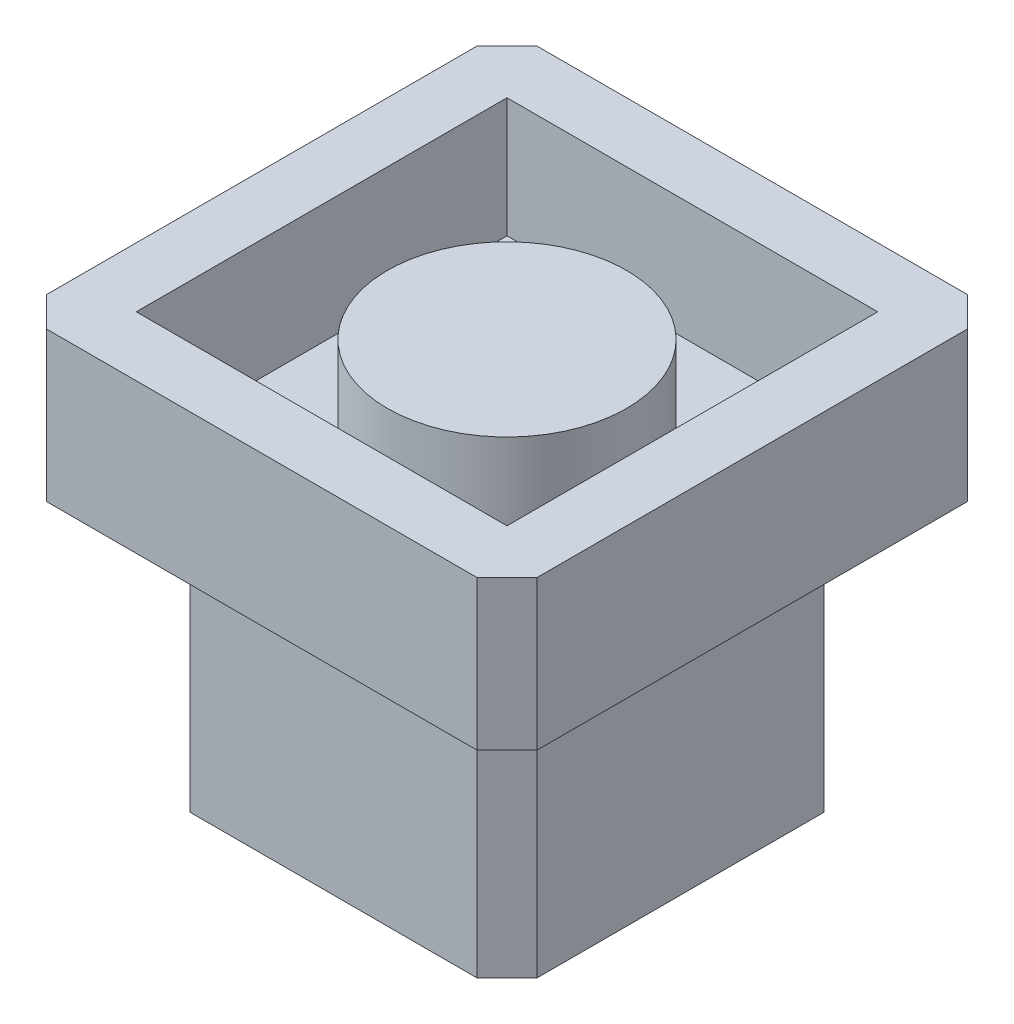
from build123d import *

# Parameters (mm, degrees)
SKETCH1_R           = 2
BOSS_EXTRUDE1_DEPTH = 1.6
SKETCH1_3_W         = 8.2
SKETCH1_3_H         = 8.2
SKETCH1_3_W_2       = 6.2
SKETCH1_3_H_2       = 6.2
BOSS_EXTRUDE2_DEPTH = 2
SKETCH1_4_W         = 8.2
SKETCH1_4_H         = 8.2
BOSS_EXTRUDE3_DEPTH = 0.5
SKETCH3_W           = 5.8
SKETCH3_H           = 5.8
BOSS_EXTRUDE4_DEPTH = 4.5
CHAMFER1_SIZE       = 0.5
CUT_EXTRUDE1_DEPTH  = 0.2


with BuildPart() as part:
    # Sketch1 → Boss-Extrude1 (new body)
    with BuildSketch(Plane(origin=(0, 0, 0), x_dir=(1, 0, 0), z_dir=(0, 1, 0))):
        Circle(SKETCH1_R)
    extrude(amount=BOSS_EXTRUDE1_DEPTH)



with BuildPart() as body_2:
    # Sketch1<3> → Boss-Extrude2 (new body)
    with BuildSketch(Plane(origin=(0, 0, 0), x_dir=(1, 0, 0), z_dir=(0, 1, 0))):
        Rectangle(SKETCH1_3_W, SKETCH1_3_H)
        Rectangle(SKETCH1_3_W_2, SKETCH1_3_H_2, mode=Mode.SUBTRACT)
    extrude(amount=BOSS_EXTRUDE2_DEPTH)


with BuildPart() as part_1:
    add(part.part)

    add(body_2.part)  # Boss-Extrude3 merges body 2
    # Sketch1<4> → Boss-Extrude3 (add)
    with BuildSketch(Plane(origin=(0, 0, 0), x_dir=(1, 0, 0), z_dir=(0, 1, 0))):
        Rectangle(SKETCH1_4_W, SKETCH1_4_H)
    extrude(amount=-BOSS_EXTRUDE3_DEPTH)

    # Sketch3 → Boss-Extrude4 (add)
    with BuildSketch(Plane.XZ.offset(0.5)):
        Rectangle(SKETCH3_W, SKETCH3_H)
    extrude(amount=BOSS_EXTRUDE4_DEPTH)

    # Chamfer1
    chamfer1_edges = [part_1.edges().sort_by_distance(p)[0] for p in [
        (-4.1, 0.75, -4.1),
        (4.1, 0.75, -4.1),
        (-4.1, 0.75, 4.1),
        (4.1, 0.75, 4.1),
        (-2.9, -2.75, 2.9),
        (2.9, -2.75, 2.9),
        (-2.9, -2.75, -2.9),
        (2.9, -2.75, -2.9),
    ]]
    chamfer(chamfer1_edges, length=CHAMFER1_SIZE)

    # Sketch4 → Cut-Extrude1 (cut)
    with BuildSketch(Plane.XZ.offset(5)):
        with BuildLine():
            Line((-1.040290833, -1.059014553), (-0.744417436, -0.881630739))
            add(Edge.make_bspline(
                [(-0.744417436, -0.881630739), (-0.716899199, -0.927695124), (-0.664175318, -1.015952708), (-0.576223959, -1.135210748), (-0.485091048, -1.236572905), (-0.390101714, -1.319449512), (-0.291835766, -1.384698399), (-0.189651712, -1.430900631), (-0.083893902, -1.459716606), (-0.01192008, -1.463216693), (0.024012051, -1.464964072)],
                knots=[0, 0, 0, 0, 1.272034388, 2.437168799, 3.508375237, 4.49857839, 5.41946034, 6.295179144, 7.148887113, 8, 8, 8, 8], degree=3))
            add(Edge.make_bspline(
                [(0.024012051, -1.464964072), (0.054698912, -1.464109399), (0.115535685, -1.462415009), (0.205097928, -1.446134207), (0.29207973, -1.421122078), (0.374688368, -1.385301147), (0.451783982, -1.341962661), (0.519390678, -1.289616484), (0.577836791, -1.231010278), (0.625645905, -1.165627623), (0.662325941, -1.095310475), (0.690518009, -1.023134523), (0.706163083, -0.947965955), (0.708519836, -0.897355492), (0.709709167, -0.871815034)],
                knots=[0, 0, 0, 0, 1.095163259, 2.171163733, 3.241058638, 4.321873601, 5.38011039, 6.391990106, 7.366004449, 8.327778327, 9.272591725, 10.192022065, 11.087607919, 12, 12, 12, 12], degree=3))
            add(Edge.make_bspline(
                [(0.709709167, -0.871815034), (0.708234856, -0.842674184), (0.705237798, -0.783435095), (0.679906318, -0.696035442), (0.640057071, -0.609542872), (0.603294427, -0.556041606), (0.584208365, -0.528265354)],
                knots=[0, 0, 0, 0, 0.938893495, 1.908633276, 2.914225137, 4, 4, 4, 4], degree=3))
            add(Edge.make_bspline(
                [(0.584208365, -0.528265354), (0.568537751, -0.50821853), (0.535639257, -0.466132732), (0.479081744, -0.403487496), (0.41271563, -0.338869077), (0.338812075, -0.269810021), (0.254678986, -0.199522224), (0.162951472, -0.124653946), (0.061287613, -0.048052369), (-0.010011884, 0.003320197), (-0.04680125, 0.029827595)],
                knots=[0, 0, 0, 0, 0.722233717, 1.516239348, 2.393582979, 3.351407094, 4.387010283, 5.505090956, 6.712668013, 8, 8, 8, 8], degree=3))
            add(Edge.make_bspline(
                [(-0.04680125, 0.029827595), (-0.083625246, 0.056056182), (-0.154029923, 0.106203245), (-0.252488505, 0.180627529), (-0.340532968, 0.248671398), (-0.417771985, 0.31097541), (-0.484171581, 0.367548015), (-0.540254992, 0.417845954), (-0.58459355, 0.463229515), (-0.60924913, 0.492670857), (-0.620318878, 0.505889293)],
                knots=[0, 0, 0, 0, 1.452282411, 2.77665338, 3.964542531, 5.026858415, 5.96415736, 6.766646006, 7.446254459, 8, 8, 8, 8], degree=3))
            add(Edge.make_bspline(
                [(-0.620318878, 0.505889293), (-0.635791423, 0.52649033), (-0.66622026, 0.567005034), (-0.706386266, 0.630329892), (-0.740525428, 0.695153157), (-0.76728776, 0.761649022), (-0.789823979, 0.828883951), (-0.80498191, 0.897735196), (-0.814473307, 0.967893815), (-0.815445293, 1.015107315), (-0.815931859, 1.038741857)],
                knots=[0, 0, 0, 0, 1.068054152, 2.10047183, 3.106115577, 4.101338837, 5.06977816, 6.043150881, 7.020423561, 8, 8, 8, 8], degree=3))
            add(Edge.make_bspline(
                [(-0.815931859, 1.038741857), (-0.81462665, 1.075771632), (-0.81204413, 1.149039696), (-0.790203613, 1.256070526), (-0.755730719, 1.358256943), (-0.707435831, 1.454587277), (-0.645178478, 1.542553258), (-0.573132504, 1.623166745), (-0.487321018, 1.690935327), (-0.393168394, 1.750147386), (-0.290112022, 1.796493311), (-0.182121119, 1.831454291), (-0.069024047, 1.851263549), (0.007579088, 1.854106314), (0.046447949, 1.855548749)],
                knots=[0, 0, 0, 0, 1.005424448, 1.989358655, 2.955360095, 3.929531133, 4.905563448, 5.876582895, 6.856512386, 7.866279853, 8.892233794, 9.918561126, 10.94386622, 12, 12, 12, 12], degree=3))
            add(Edge.make_bspline(
                [(0.046447949, 1.855548749), (0.087692049, 1.854126197), (0.169713401, 1.851297196), (0.290362616, 1.826699664), (0.406523333, 1.785998993), (0.499966598, 1.739810335), (0.573099359, 1.693678919), (0.628872092, 1.651659095), (0.685389543, 1.603283986), (0.743107597, 1.54842474), (0.801048257, 1.486577989), (0.860071709, 1.4181673), (0.920315978, 1.343610744), (0.959071838, 1.290386243), (0.978939936, 1.263100832)],
                knots=[0, 0, 0, 0, 1.286793592, 2.559021753, 3.825965368, 5.121522368, 5.803751409, 6.523245864, 7.299691795, 8.125521123, 9.008227632, 9.944561021, 10.946284179, 12, 12, 12, 12], degree=3))
            Line((0.978939936, 1.263100832), (0.694985609, 1.047856441))
            add(Edge.make_bspline(
                [(0.694985609, 1.047856441), (0.677839677, 1.069945131), (0.644820619, 1.112482784), (0.594691133, 1.1720541), (0.547442485, 1.22647058), (0.500892085, 1.273735708), (0.457498453, 1.316437841), (0.415381411, 1.352997598), (0.37514706, 1.383773193), (0.324430149, 1.416616753), (0.260712431, 1.449173257), (0.180727895, 1.476722335), (0.09714162, 1.493277397), (0.040211988, 1.495466284), (0.011391859, 1.49657439)],
                knots=[0, 0, 0, 0, 1.181633172, 2.275549214, 3.290209073, 4.226197932, 5.078386478, 5.862611352, 6.581680152, 7.217281963, 8.414376989, 9.595101626, 10.782541182, 12, 12, 12, 12], degree=3))
            add(Edge.make_bspline(
                [(0.011391859, 1.49657439), (-0.024764663, 1.49536269), (-0.094489111, 1.49302604), (-0.193479347, 1.467506055), (-0.282573272, 1.427324195), (-0.359125837, 1.371009217), (-0.422862814, 1.304288224), (-0.468968273, 1.227509369), (-0.496718437, 1.142726966), (-0.500104717, 1.08358531), (-0.501829295, 1.053465415)],
                knots=[0, 0, 0, 0, 1.14458467, 2.207223713, 3.21896685, 4.227309161, 5.202851033, 6.127160689, 7.046193047, 8, 8, 8, 8], degree=3))
            add(Edge.make_bspline(
                [(-0.501829295, 1.053465415), (-0.501436168, 1.034713937), (-0.500649272, 0.997180317), (-0.489674474, 0.941728895), (-0.475575145, 0.886417556), (-0.453232514, 0.831494973), (-0.42238721, 0.776000614), (-0.381882034, 0.718978876), (-0.330868722, 0.659927168), (-0.29179171, 0.621519794), (-0.271160224, 0.601241857)],
                knots=[0, 0, 0, 0, 0.858281714, 1.717966888, 2.583508476, 3.4729293, 4.427298488, 5.488583878, 6.674047936, 8, 8, 8, 8], degree=3))
            add(Edge.make_bspline(
                [(-0.271160224, 0.601241857), (-0.263498852, 0.594404832), (-0.245297185, 0.578161623), (-0.212021259, 0.551569343), (-0.168078461, 0.51876657), (-0.11461626, 0.478179254), (-0.050648898, 0.431097792), (0.023830658, 0.37812418), (0.107992191, 0.317538721), (0.167714107, 0.27518118), (0.1992925, 0.252784325)],
                knots=[0, 0, 0, 0, 0.420754252, 0.999615792, 1.744751191, 2.668019286, 3.750313428, 4.999500688, 6.413464383, 8, 8, 8, 8], degree=3))
            add(Edge.make_bspline(
                [(0.1992925, 0.252784325), (0.237278413, 0.225142966), (0.31083287, 0.171619304), (0.41549045, 0.091203624), (0.510384258, 0.012555856), (0.595847461, -0.063821752), (0.67272437, -0.137349845), (0.74016209, -0.208913025), (0.798847771, -0.277998598), (0.862026989, -0.366571173), (0.926584809, -0.475352258), (0.982026316, -0.608630496), (1.016984664, -0.742426817), (1.021556179, -0.832353653), (1.023811731, -0.876722886)],
                knots=[0, 0, 0, 0, 1.163667725, 2.253281268, 3.268753668, 4.215851969, 5.092017293, 5.902905408, 6.650798638, 7.335211899, 8.59617414, 9.77448103, 10.901945474, 12, 12, 12, 12], degree=3))
            add(Edge.make_bspline(
                [(1.023811731, -0.876722886), (1.023154593, -0.908101251), (1.021853078, -0.970248635), (1.006892164, -1.061503712), (0.984972499, -1.150134581), (0.951935265, -1.235045694), (0.911612106, -1.317790456), (0.860445859, -1.396198357), (0.801138174, -1.472004755), (0.733104409, -1.543188247), (0.658658507, -1.608534443), (0.579974812, -1.666663504), (0.496924539, -1.715131828), (0.409958222, -1.75468267), (0.319055886, -1.785616187), (0.224248102, -1.808029056), (0.125378591, -1.821784767), (0.058178109, -1.823212529), (0.024012051, -1.823938431)],
                knots=[0, 0, 0, 0, 0.983748083, 1.948392443, 2.894712957, 3.844097841, 4.80183111, 5.778335162, 6.776009319, 7.81870978, 8.863265674, 9.881300176, 10.883814829, 11.87499822, 12.874611388, 13.892143829, 14.928324115, 16, 16, 16, 16], degree=3))
            add(Edge.make_bspline(
                [(0.024012051, -1.823938431), (-0.002423292, -1.823427249), (-0.054961052, -1.822411324), (-0.132670534, -1.813430044), (-0.208810123, -1.80072294), (-0.282424405, -1.78054887), (-0.354461816, -1.756071893), (-0.424609051, -1.72593356), (-0.492900105, -1.689816359), (-0.559717688, -1.648521334), (-0.624891862, -1.60046359), (-0.68781133, -1.544490093), (-0.750540516, -1.482144588), (-0.811227912, -1.411734025), (-0.871101056, -1.334395942), (-0.928979466, -1.249406759), (-0.986061184, -1.157229405), (-1.021876651, -1.092364319), (-1.040290833, -1.059014553)],
                knots=[0, 0, 0, 0, 0.915332311, 1.819136955, 2.706846663, 3.586547465, 4.459518054, 5.340707479, 6.227863349, 7.133153174, 8.059268498, 9.028702269, 10.047606654, 11.120612155, 12.245963614, 13.433783089, 14.680604001, 16, 16, 16, 16], degree=3))
        make_face()
    extrude(amount=-CUT_EXTRUDE1_DEPTH, mode=Mode.SUBTRACT)


solid = part_1.part
